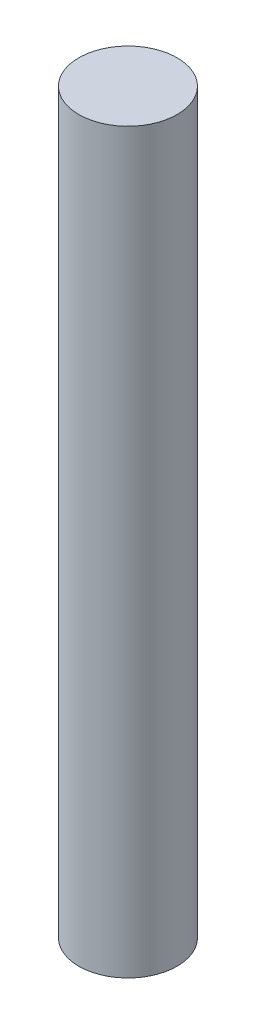
from build123d import *

# Parameters (mm, degrees)
SKETCH1_R           = 2
BOSS_EXTRUDE1_DEPTH = 30


with BuildPart() as part:
    # Sketch1 → Boss-Extrude1 (new body)
    with BuildSketch(Plane(origin=(0, 0, 0), x_dir=(1, 0, 0), z_dir=(0, 1, 0))):
        with Locations(Location((0, 0, 0), (0, 0, 270))):
            Circle(SKETCH1_R)
    extrude(amount=BOSS_EXTRUDE1_DEPTH)


solid = part.part
